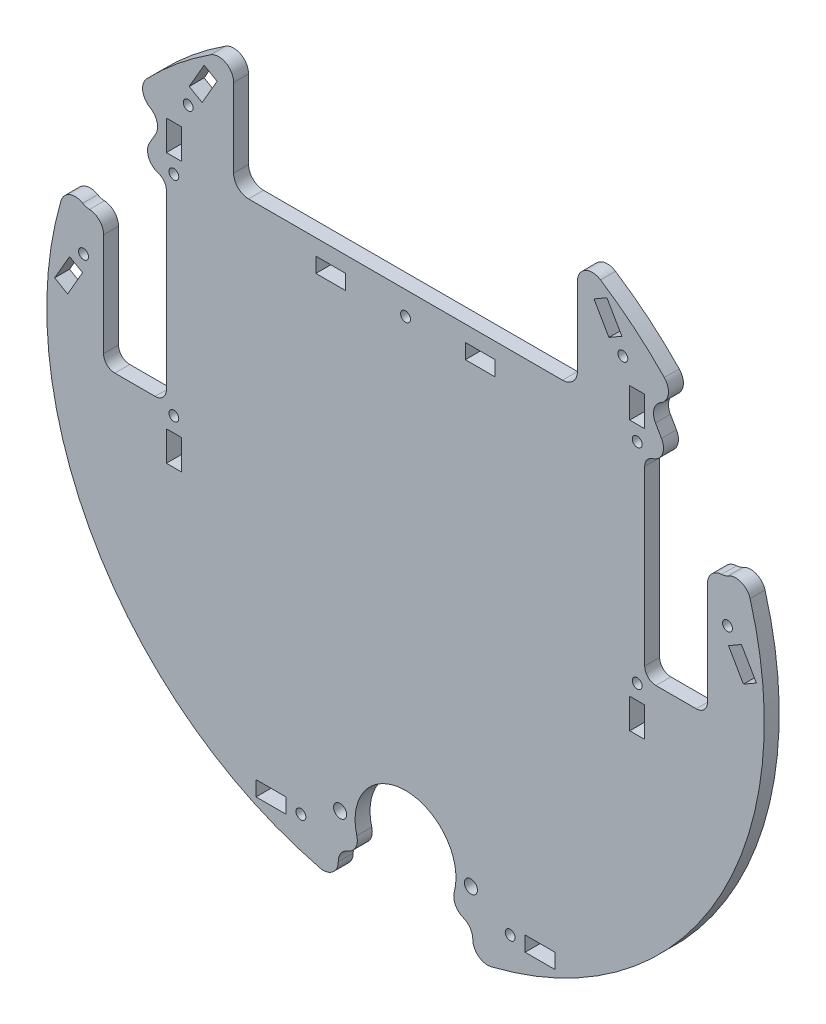
from build123d import *

# Parameters (mm, degrees)
SKETCH1_R           = 152.4
BOSS_EXTRUDE1_DEPTH = 6.35
SKETCH3_W           = 57.15
SKETCH3_H           = 38.1
CUT_EXTRUDE1_DEPTH  = 6.35
SKETCH4_W           = 26.67
SKETCH4_H           = 82.55
CUT_EXTRUDE2_DEPTH  = 6.35
SKETCH5_R           = 2.0955
SKETCH5_W           = 12.7
SKETCH5_H           = 6.35
CUT_EXTRUDE3_DEPTH  = 6.35
SKETCH6_R           = 2.0955
SKETCH6_W           = 6.35
SKETCH6_H           = 12.7
CUT_EXTRUDE4_DEPTH  = 6.35
CUT_EXTRUDE5_DEPTH  = 6.35
CIRPATTERN1_COUNT   = 3
FILLET1_R           = 6.35
FILLET2_R           = 6.35
FILLET3_R           = 4.7625
FILLET4_R           = 6.35
SKETCH8_R           = 2.778125
SKETCH8_R_2         = 21.43125
CUT_EXTRUDE6_DEPTH  = 6.35
FILLET5_R           = 6.35
CUT_EXTRUDE7_REACH  = 214.646
SKETCH9_R           = 2.0955
SKETCH9_W           = 12.7
SKETCH9_H           = 6.35


with BuildPart() as part:
    # Sketch1 → Boss-Extrude1 (new body)
    with BuildSketch(Plane.XY):
        Circle(SKETCH1_R)
    extrude(amount=BOSS_EXTRUDE1_DEPTH)

    # Sketch3 → Cut-Extrude1 (cut)
    with BuildSketch(Plane.XY.offset(6.35)):
        with Locations((0, -154.500129199)):
            Rectangle(SKETCH3_W, SKETCH3_H)
    cut_extrude1 = extrude(amount=-CUT_EXTRUDE1_DEPTH, mode=Mode.SUBTRACT)

    # Sketch4 → Cut-Extrude2 (cut)
    with BuildSketch(Plane.XY.offset(6.35)):
        with Locations((114.935, 31.75)):
            Rectangle(SKETCH4_W, SKETCH4_H)
    cut_extrude2 = extrude(amount=-CUT_EXTRUDE2_DEPTH, mode=Mode.SUBTRACT)

    # Sketch5 → Cut-Extrude3 (cut)
    with BuildSketch(Plane.XY.offset(6.35)):
        with Locations((-44.45, -132.275129199)):
            Circle(SKETCH5_R)
        with Locations(Location((44.45, -132.275129199, 0), (0, 0, 180))):
            Circle(SKETCH5_R)
        with Locations((-57.15, -132.275129199)):
            Rectangle(SKETCH5_W, SKETCH5_H)
        with Locations((57.15, -132.275129199)):
            Rectangle(SKETCH5_W, SKETCH5_H)
    cut_extrude3 = extrude(amount=-CUT_EXTRUDE3_DEPTH, mode=Mode.SUBTRACT)

    # Sketch6 → Cut-Extrude4 (cut)
    with BuildSketch(Plane.XY.offset(6.35)):
        with Locations((98.425, 76.2)):
            Circle(SKETCH6_R)
        with Locations(Location((98.425, -12.7, 0), (0, 0, 180))):
            Circle(SKETCH6_R)
        with Locations((98.425, 88.9)):
            Rectangle(SKETCH6_W, SKETCH6_H)
        with Locations((98.425, -25.4)):
            Rectangle(SKETCH6_W, SKETCH6_H)
    cut_extrude4 = extrude(amount=-CUT_EXTRUDE4_DEPTH, mode=Mode.SUBTRACT)

    # Sketch7 → Cut-Extrude5 (cut)
    with BuildSketch(Plane.XY.offset(6.35)):
        Polygon((73.025, 133.765127649), (73.025, 82.965127649), (0, 82.965127649), (0, 215.740141909), align=None)
    cut_extrude5 = extrude(amount=-CUT_EXTRUDE5_DEPTH, mode=Mode.SUBTRACT)

    # Mirror1: Cut-Extrude2, Cut-Extrude4, Cut-Extrude5 across plane
    add(cut_extrude2.mirror(Plane(origin=(0, 0, 0), x_dir=(0, 0, 1), z_dir=(1, 0, 0))), mode=Mode.SUBTRACT)
    add(cut_extrude4.mirror(Plane(origin=(0, 0, 0), x_dir=(0, 0, 1), z_dir=(1, 0, 0))), mode=Mode.SUBTRACT)
    add(cut_extrude5.mirror(Plane(origin=(0, 0, 0), x_dir=(0, 0, 1), z_dir=(1, 0, 0))), mode=Mode.SUBTRACT)

    # CirPattern1: Cut-Extrude1, Cut-Extrude3 ×3 about axis
    cirpattern1_axis = Axis((0, 0, 0), (0, 0, 1))
    add([cut_extrude1.rotate(cirpattern1_axis, i * 360 / CIRPATTERN1_COUNT) for i in range(1, CIRPATTERN1_COUNT)], mode=Mode.SUBTRACT)
    add([cut_extrude3.rotate(cirpattern1_axis, i * 360 / CIRPATTERN1_COUNT) for i in range(1, CIRPATTERN1_COUNT)], mode=Mode.SUBTRACT)

    # Fillet1
    fillet1_edges = [part.edges().sort_by_distance(p)[0] for p in [
        (28.575, -149.697125473, 3.175),
        (28.575, -135.450129199, 3.175),
        (-28.575, -149.697125473, 3.175),
        (-28.575, -135.450129199, 3.175),
        (-115.354013533, 99.59523865, 3.175),
        (-143.929013533, 50.101886824, 3.175),
        (-131.590752832, 42.978388686, 3.175),
        (-103.015752832, 92.471740513, 3.175),
        (143.929013533, 50.101886824, 3.175),
        (115.354013533, 99.59523865, 3.175),
        (103.015752832, 92.471740513, 3.175),
        (131.590752832, 42.978388686, 3.175),
    ]]
    fillet(fillet1_edges, radius=FILLET1_R)

    # Fillet2
    fillet2_edges = [part.edges().sort_by_distance(p)[0] for p in [
        (128.27, 48.730101311, 3.175),
        (114.243333702, 73.025, 3.175),
        (-128.27, 48.730101311, 3.175),
        (-114.243333702, 73.025, 3.175),
    ]]
    fillet(fillet2_edges, radius=FILLET2_R)

    # Fillet3
    fillet3_edges = [part.edges().sort_by_distance(p)[0] for p in [
        (128.27, -9.525, 3.175),
        (101.6, -9.525, 3.175),
        (-128.27, -9.525, 3.175),
        (-101.6, -9.525, 3.175),
        (101.6, 73.025, 3.175),
        (-103.244811074, 73.025, 3.175),
        (-101.6, 73.025, 3.175),
    ]]
    fillet(fillet3_edges, radius=FILLET3_R)

    # Fillet4
    fillet4_edges = [part.edges().sort_by_distance(p)[0] for p in [
        (73.025, 133.765127649, 3.175),
        (73.025, 82.965127649, 3.175),
        (-73.025, 133.765127649, 3.175),
        (-73.025, 82.965127649, 3.175),
    ]]
    fillet(fillet4_edges, radius=FILLET4_R)

    # Sketch8 → Cut-Extrude6 (cut)
    with BuildSketch(Plane(origin=(0, 0, 0), x_dir=(-1, 0, 0), z_dir=(0, 0, -1))):
        with Locations((-27.78125, -122.750129199)):
            Circle(SKETCH8_R)
        with Locations((27.78125, -122.750129199)):
            Circle(SKETCH8_R)
        with Locations((0, -122.750129199)):
            Circle(SKETCH8_R_2)
    extrude(amount=-CUT_EXTRUDE6_DEPTH, mode=Mode.SUBTRACT)

    # Fillet5
    fillet5_edges = [part.edges().sort_by_distance(p)[0] for p in [
        (-17.262922017, -135.450129199, 3.175),
        (17.262922017, -135.450129199, 3.175),
    ]]
    fillet(fillet5_edges, radius=FILLET5_R)

    # Sketch9 → Cut-Extrude7 (cut, up to next)
    with BuildSketch(Plane(origin=(0, 0, 0), x_dir=(-1, 0, 0), z_dir=(0, 0, -1)), mode=Mode.PRIVATE) as cut_extrude7_sk1:
        with Locations((0, 73.025)):
            Circle(SKETCH9_R)
    cut_extrude7_tool1 = extrude(cut_extrude7_sk1.sketch, amount=-CUT_EXTRUDE7_REACH, mode=Mode.PRIVATE) & part.part
    # Sketch9 → Cut-Extrude7 (cut, up to next)
    with BuildSketch(Plane(origin=(0, 0, 0), x_dir=(-1, 0, 0), z_dir=(0, 0, -1)), mode=Mode.PRIVATE) as cut_extrude7_sk2:
        with Locations((31.75, 73.025)):
            Rectangle(SKETCH9_W, SKETCH9_H)
    cut_extrude7_tool2 = extrude(cut_extrude7_sk2.sketch, amount=-CUT_EXTRUDE7_REACH, mode=Mode.PRIVATE) & part.part
    # Sketch9 → Cut-Extrude7 (cut, up to next)
    with BuildSketch(Plane(origin=(0, 0, 0), x_dir=(-1, 0, 0), z_dir=(0, 0, -1)), mode=Mode.PRIVATE) as cut_extrude7_sk3:
        with Locations((-31.75, 73.025)):
            Rectangle(SKETCH9_W, SKETCH9_H)
    cut_extrude7_tool3 = extrude(cut_extrude7_sk3.sketch, amount=-CUT_EXTRUDE7_REACH, mode=Mode.PRIVATE) & part.part
    add(cut_extrude7_tool1.solids().sort_by_distance((0, 73.025, 0))[0], mode=Mode.SUBTRACT)
    add(cut_extrude7_tool2.solids().sort_by_distance((-31.75, 73.025, 0))[0], mode=Mode.SUBTRACT)
    add(cut_extrude7_tool3.solids().sort_by_distance((31.75, 73.025, 0))[0], mode=Mode.SUBTRACT)


solid = part.part
